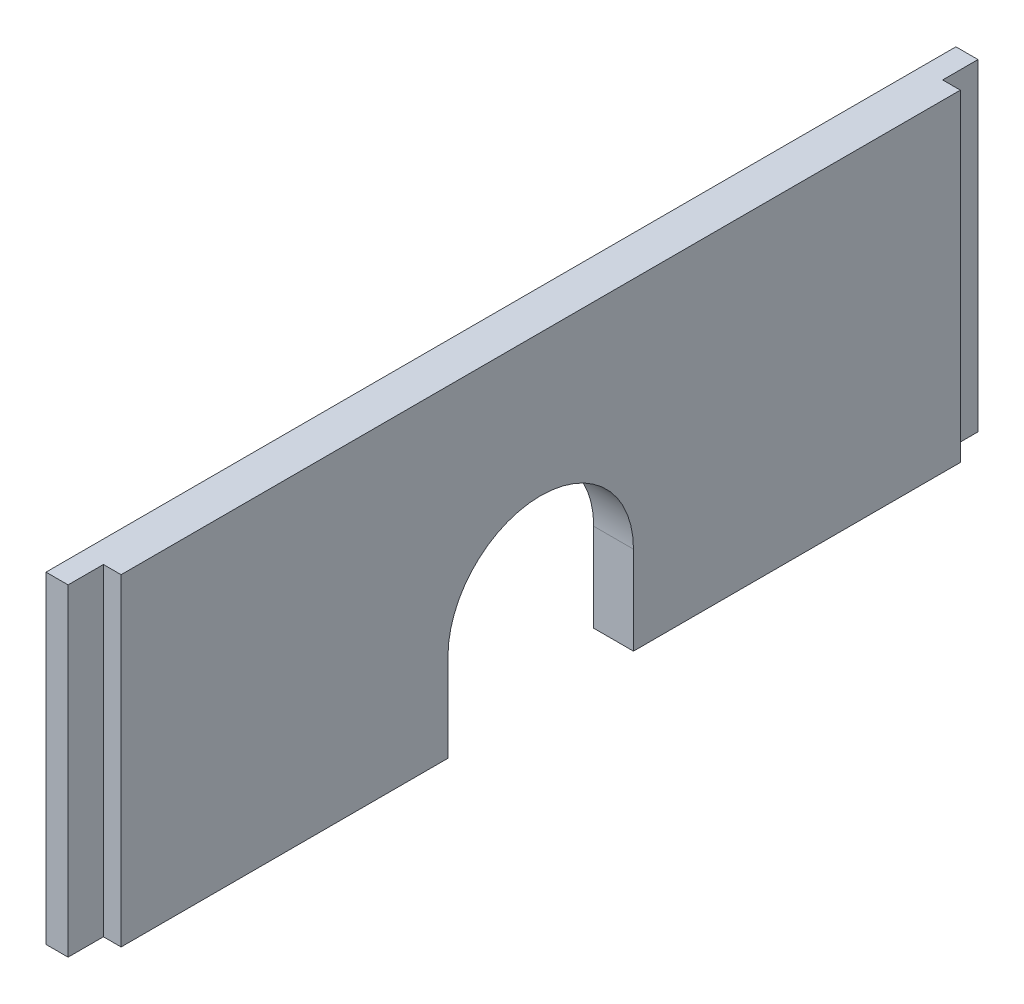
from build123d import *

# Parameters (mm, degrees)
SKETCH_1_W          = 2.5
SKETCH_1_H          = 103
SKETCH_1_W_2        = 2
SKETCH_1_H_2        = 95
EXTRUDE_1_DEPTH     = 99.5
CUT_EXTRUDE_2_DEPTH = 4.5
CUT_EXTRUDE_3_DEPTH = 58.5
CUT_EXTRUDE_4_DEPTH = 4.5
SKETCH_6_W          = 1.6
SKETCH_6_H          = 17
CUT_EXTRUDE_5_DEPTH = 10


with BuildPart() as part:
    # 스케치1 → 보스-돌출1 (new body)
    with BuildSketch(Plane(origin=(0, 0, 0), x_dir=(1, 0, 0), z_dir=(0, 1, 0))):
        with Locations((1.25, -51.5)):
            Rectangle(SKETCH_1_W, SKETCH_1_H)
        with Locations((3.5, -51.5)):
            Rectangle(SKETCH_1_W_2, SKETCH_1_H_2)
    extrude(amount=EXTRUDE_1_DEPTH)

    # 스케치2 → 컷-돌출2 (cut)
    with BuildSketch(Plane(origin=(4.5, 0, 0), x_dir=(0, 0, -1), z_dir=(1, 0, 0))):
        with BuildLine():
            Line((-62, 10), (-62, 0))
            Line((-62, 0), (-41, 0))
            Line((-41, 0), (-41, 10))
            ThreePointArc((-41, 10), (-51.5, 20.5), (-62, 10))
        make_face()
    extrude(amount=-CUT_EXTRUDE_2_DEPTH, mode=Mode.SUBTRACT)

    # 스케치3 → 컷-돌출3 (cut)
    with BuildSketch(Plane(origin=(0, 99.5, 0), x_dir=(1, 0, 0), z_dir=(0, 1, 0))):
        Polygon((2.5, -4), (2.5, 0), (0, 0), (0, -103), (2.5, -103), (2.5, -99), (4.5, -99), (4.5, -4), align=None)
    extrude(amount=-CUT_EXTRUDE_3_DEPTH, mode=Mode.SUBTRACT)

    # 스케치4 → 컷-돌출4 (cut)
    with BuildSketch(Plane(origin=(0, 41, 0), x_dir=(1, 0, 0), z_dir=(0, 1, 0))):
        Polygon((4.5, -4), (2.5, -4), (2.5, 0), (0, 0), (0, -103), (2.5, -103), (2.5, -99), (4.5, -99), align=None)
    extrude(amount=-CUT_EXTRUDE_4_DEPTH, mode=Mode.SUBTRACT)

    # 스케치6 → 컷-돌출5 (cut)
    with BuildSketch(Plane.XZ):
        with Locations((0.8, 74)):
            Rectangle(SKETCH_6_W, SKETCH_6_H)
    extrude(amount=-CUT_EXTRUDE_5_DEPTH, mode=Mode.SUBTRACT)


solid = part.part
